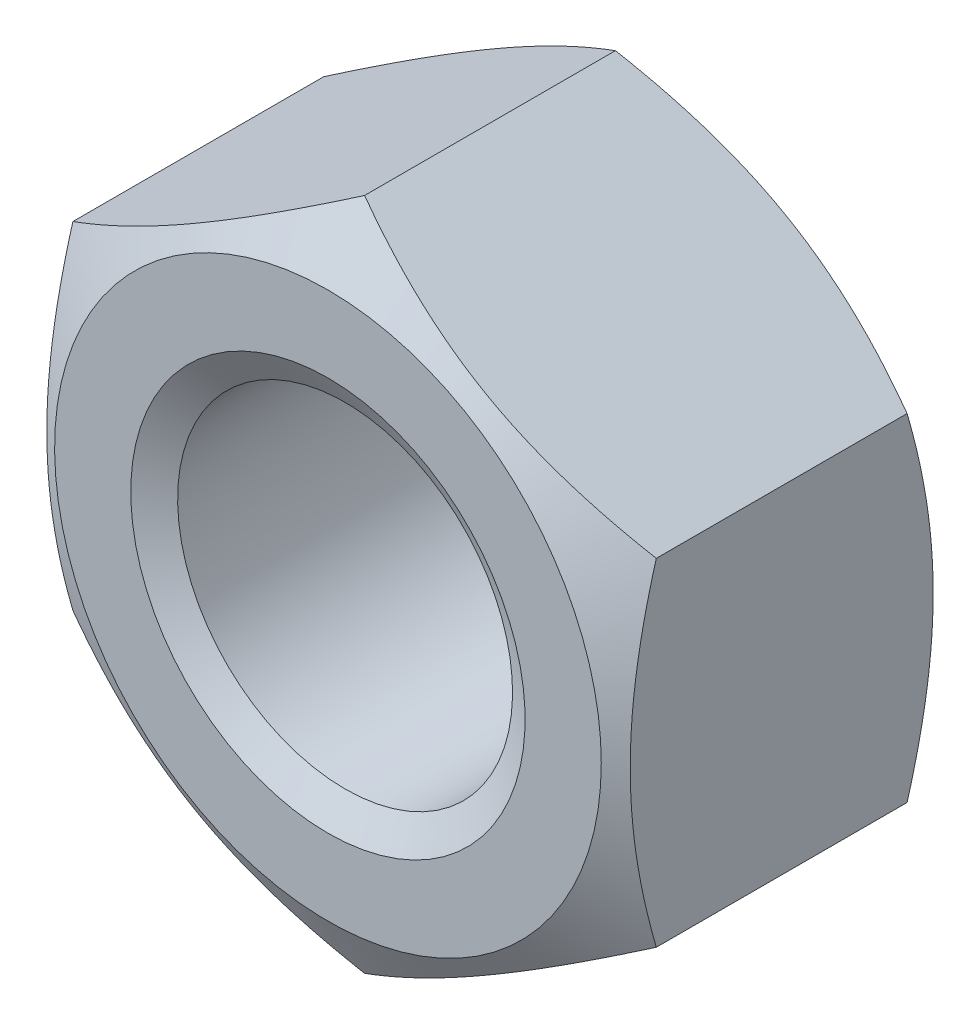
from build123d import *

# Parameters (mm, degrees)
BOSS_EXTRUDE1_DEPTH = 15


with BuildPart() as part:
    # Sketch1 → Boss-Extrude1 (new body)
    with BuildSketch(Plane.XY):
        Polygon((0, 15.588457268), (-13.5, 7.794228634), (-13.5, -7.794228634), (0, -15.588457268), (13.5, -7.794228634), (13.5, 7.794228634), align=None)
    extrude(amount=-BOSS_EXTRUDE1_DEPTH)

    # Sketch4 → Cut-Revolve1 (revolve, cut)
    with BuildSketch(Plane(origin=(0, 0, 0), x_dir=(0, 0, -1), z_dir=(1, 0, 0)), mode=Mode.PRIVATE) as cut_revolve1_sk:
        Polygon((15, 15.588457268), (13.303480905, 15.588457268), (15, 12.65), align=None)
        Polygon((0, 15.588457268), (1.696519095, 15.588457268), (0, 12.65), align=None)
    revolve(cut_revolve1_sk.sketch.rotate(Axis((0, 0, 0), (0, 0, -1)), 300.000000005), axis=Axis((0, 0, 0), (0, 0, -1)), mode=Mode.SUBTRACT)

    # Sketch5 → Cut-Revolve2 (revolve, cut)
    with BuildSketch(Plane(origin=(0, 0, 0), x_dir=(0, 0, -1), z_dir=(1, 0, 0)), mode=Mode.PRIVATE) as cut_revolve2_sk:
        Polygon((0, 0), (0, 9.125), (0.79385662, 7.75), (14.20614338, 7.75), (15, 9.125), (15, 0), align=None)
    revolve(cut_revolve2_sk.sketch.rotate(Axis((0, 0, 0), (0, 0, -1)), 180), axis=Axis((0, 0, 0), (0, 0, -1)), mode=Mode.SUBTRACT)


solid = part.part
